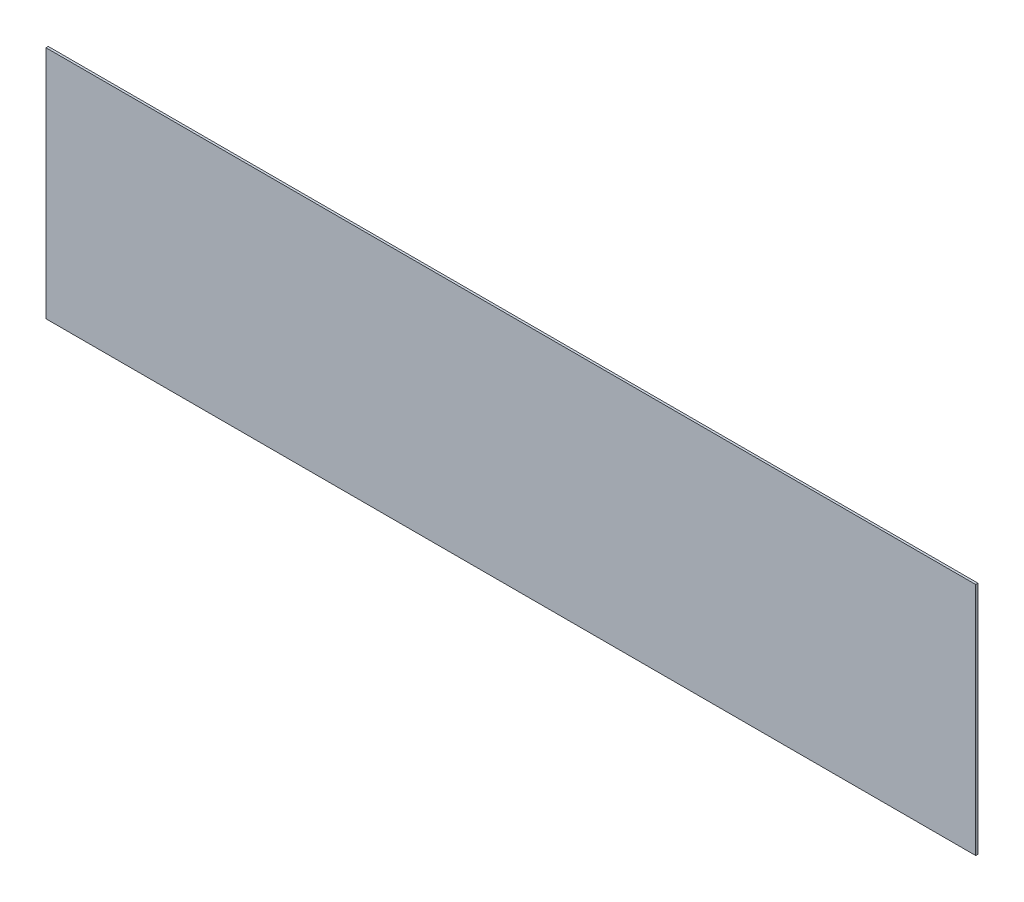
from build123d import *

# Parameters (mm, degrees)
SKETCH2_W           = 203.2
SKETCH2_H           = 51.308
BOSS_EXTRUDE1_DEPTH = 0.5


with BuildPart() as part:
    # Sketch2 → Boss-Extrude1 (new body)
    with BuildSketch(Plane.XY):
        with Locations((101.6, 25.654)):
            Rectangle(SKETCH2_W, SKETCH2_H)
    extrude(amount=BOSS_EXTRUDE1_DEPTH)


solid = part.part
